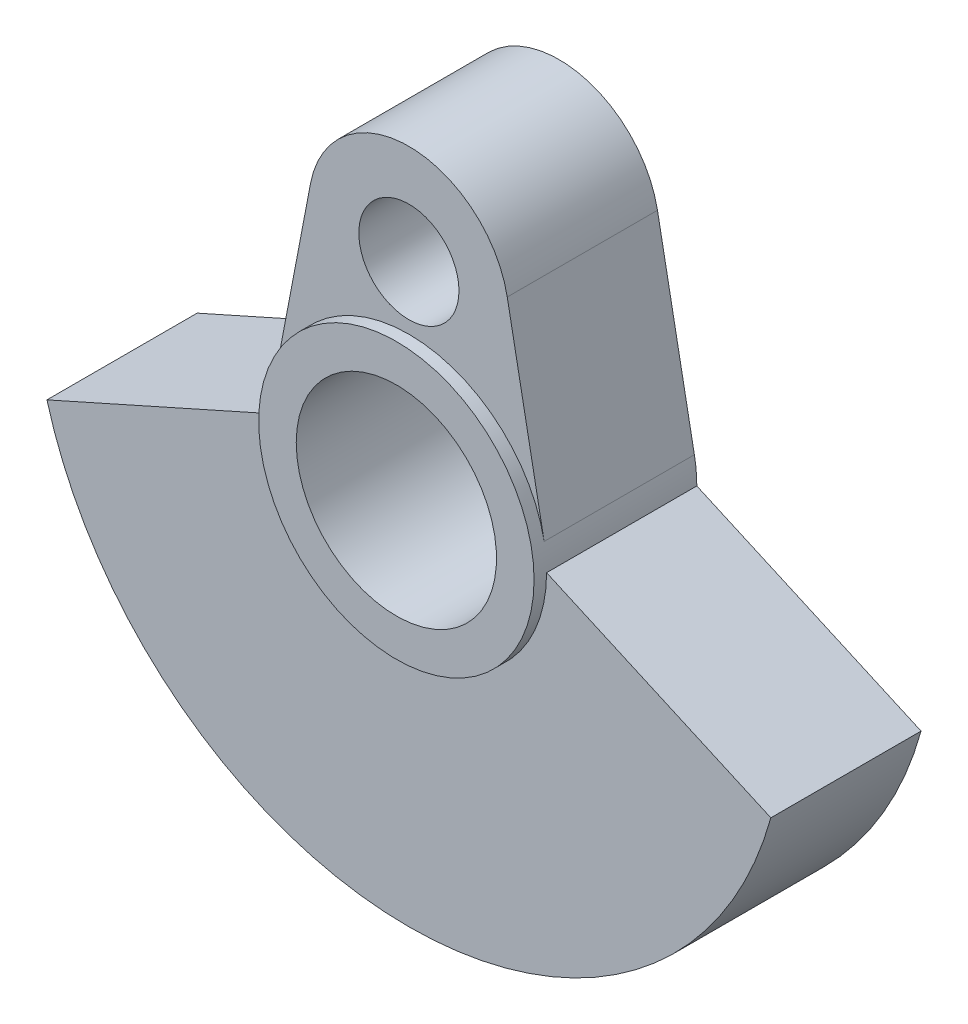
from build123d import *

# Parameters (mm, degrees)
BOSS_EXTRUDE1_DEPTH   = 3
SKETCH1_R             = 2
BOSS_EXTRUDE1_2_DEPTH = 3
BOSS_EXTRUDE2_START   = 3.5
SKETCH1_4_R           = 5.5
SKETCH1_4_R_2         = 4
BOSS_EXTRUDE2_DEPTH   = 6.5


with BuildPart() as part:
    # Sketch1 → Boss-Extrude1 (new, symmetric)
    with BuildSketch(Plane.XY):
        with BuildLine():
            Line((-5.5, 0), (-14.456832295, -4))
            ThreePointArc((-14.456832295, -4), (0, -15), (14.456832295, -4))
            Line((14.456832295, -4), (5.5, 0))
            ThreePointArc((5.5, 0), (0, -5.5), (-5.5, 0))
        make_face()
    extrude(amount=BOSS_EXTRUDE1_DEPTH, both=True)



with BuildPart() as body_2:
    # Sketch1 → Boss-Extrude1 2 (new, symmetric)
    with BuildSketch(Plane.XY):
        with BuildLine():
            Line((-3.929058411, 8.75), (-5.402455316, 1.03125))
            ThreePointArc((-5.402455316, 1.03125), (0, 5.5), (5.402455316, 1.03125))
            Line((5.402455316, 1.03125), (3.929058411, 8.75))
            ThreePointArc((3.929058411, 8.75), (0, 12), (-3.929058411, 8.75))
        make_face()
        with Locations((0, 8)):
            Circle(SKETCH1_R, mode=Mode.SUBTRACT)
    extrude(amount=BOSS_EXTRUDE1_2_DEPTH, both=True)


with BuildPart() as part_1:
    add(part.part)

    add(body_2.part)  # Boss-Extrude2 merges body 2
    # Sketch1<4> → Boss-Extrude2 (add)
    with BuildSketch(Plane.XY.offset(BOSS_EXTRUDE2_START)):
        Circle(SKETCH1_4_R)
        with Locations(Location((0, 0, 0), (0, 0, 180))):
            Circle(SKETCH1_4_R_2, mode=Mode.SUBTRACT)
    extrude(amount=-BOSS_EXTRUDE2_DEPTH)


solid = part_1.part
